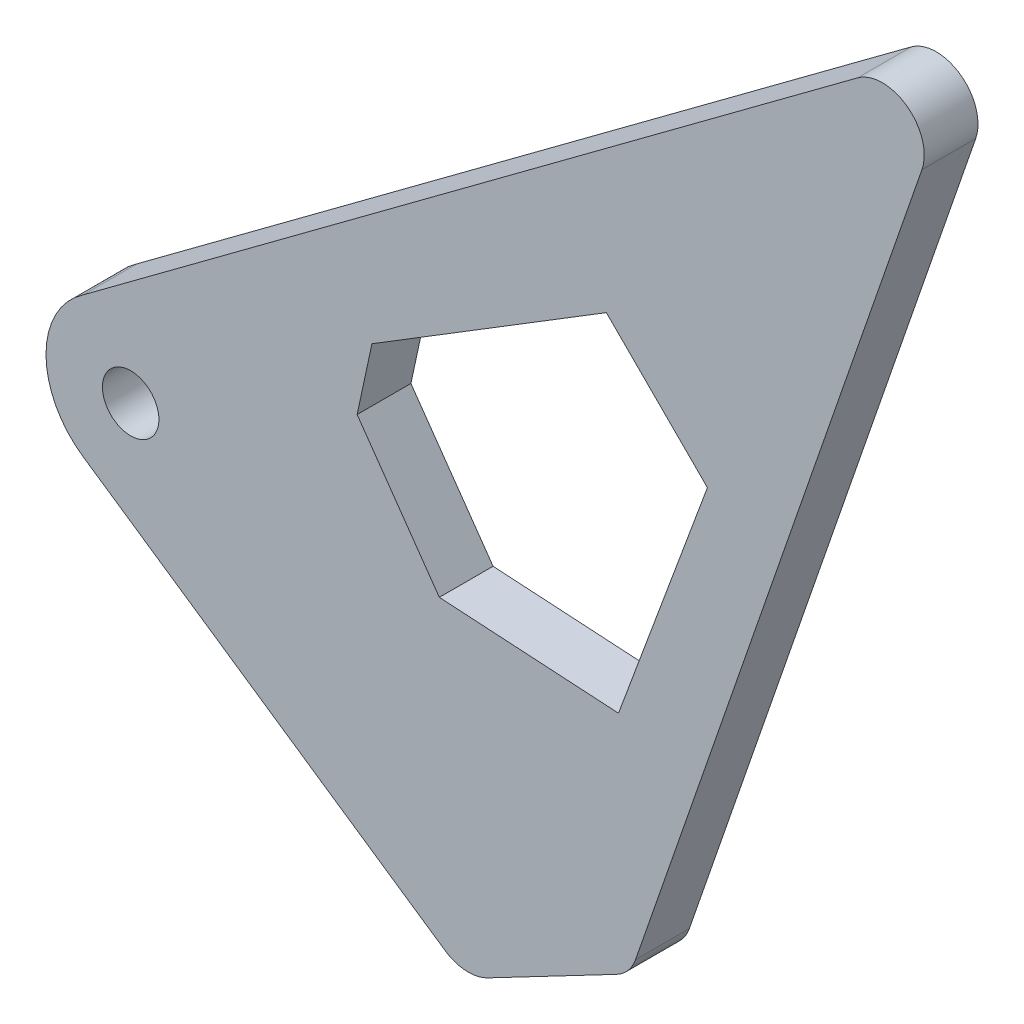
from build123d import *

# Parameters (mm, degrees)
SKETCH1_R           = 15
SKETCH1_R_2         = 7.343075537
SKETCH1_R_3         = 7.048050761
SKETCH1_R_4         = 7.405031705
BOSS_EXTRUDE1_DEPTH = 4.7625
SKETCH3_R           = 5
CUT_EXTRUDE1_DEPTH  = 9.525
CUT_EXTRUDE2_DEPTH  = 18.375


with BuildPart() as part:
    # Sketch1 → Boss-Extrude1 (new, symmetric)
    with BuildSketch(Plane.XY):
        with Locations((-135.989964622, 14.806967819)):
            Circle(SKETCH1_R)
        with BuildLine():
            Line((-144.43677034, 2.411344674), (-80.310762347, -41.286331891))
            ThreePointArc((-80.310762347, -41.286331891), (-79.60770007, -28.726487254), (-68.832651313, -35.218198752))
            ThreePointArc((-68.832651313, -35.218198752), (-69.89332652, -39.019804259), (-72.768932333, -41.723159126))
            Line((-72.768932333, -41.723159126), (-49.966216141, -29.780862162))
            ThreePointArc((-49.966216141, -29.780862162), (-59.266125529, -19.888386029), (-46.188084172, -23.53725338))
            ThreePointArc((-46.188084172, -23.53725338), (-46.285689954, -24.706156337), (-46.575803889, -25.842683907))
            Line((-46.575803889, -25.842683907), (4.15447513, 120.715821505))
            ThreePointArc((4.15447513, 120.715821505), (-7.221463009, 117.165978053), (-7.258334859, 129.082856736))
            Line((-7.258334859, 129.082856736), (-144.43677034, 27.202590964))
            ThreePointArc((-144.43677034, 27.202590964), (-128.979332902, 28.06785176), (-120.989964622, 14.806967819))
            ThreePointArc((-120.989964622, 14.806967819), (-128.979332902, 1.546083878), (-144.43677034, 2.411344674))
        make_face()
        with Locations((-76.175726851, -35.218198752)):
            Circle(SKETCH1_R_2)
        with Locations((-53.236134933, -23.53725338)):
            Circle(SKETCH1_R_3)
        with Locations((-2.84319901, 123.138021163)):
            Circle(SKETCH1_R_4)
    extrude(amount=BOSS_EXTRUDE1_DEPTH, both=True)

    # Sketch3 → Cut-Extrude1 (cut)
    with BuildSketch(Plane(origin=(0, 0, -4.7625), x_dir=(-1, 0, 0), z_dir=(0, 0, -1))):
        with Locations((135.989964622, 14.806967819)):
            Circle(SKETCH3_R)
    extrude(amount=-CUT_EXTRUDE1_DEPTH, mode=Mode.SUBTRACT)

    # Sketch5 → Cut-Extrude2 (cut)
    with BuildSketch(Plane(origin=(0, 0, -4.7625), x_dir=(-1, 0, 0), z_dir=(0, 0, -1))):
        Polygon((51.738143119, 70.835792845), (33.841540749, 52.939190474), (49.590550835, 10.464587516), (81.327192371, 12.373558435), (95.883095633, 33.133617185), (93.258260618, 45.303306796), align=None)
    extrude(amount=-CUT_EXTRUDE2_DEPTH, mode=Mode.SUBTRACT)


solid = part.part
